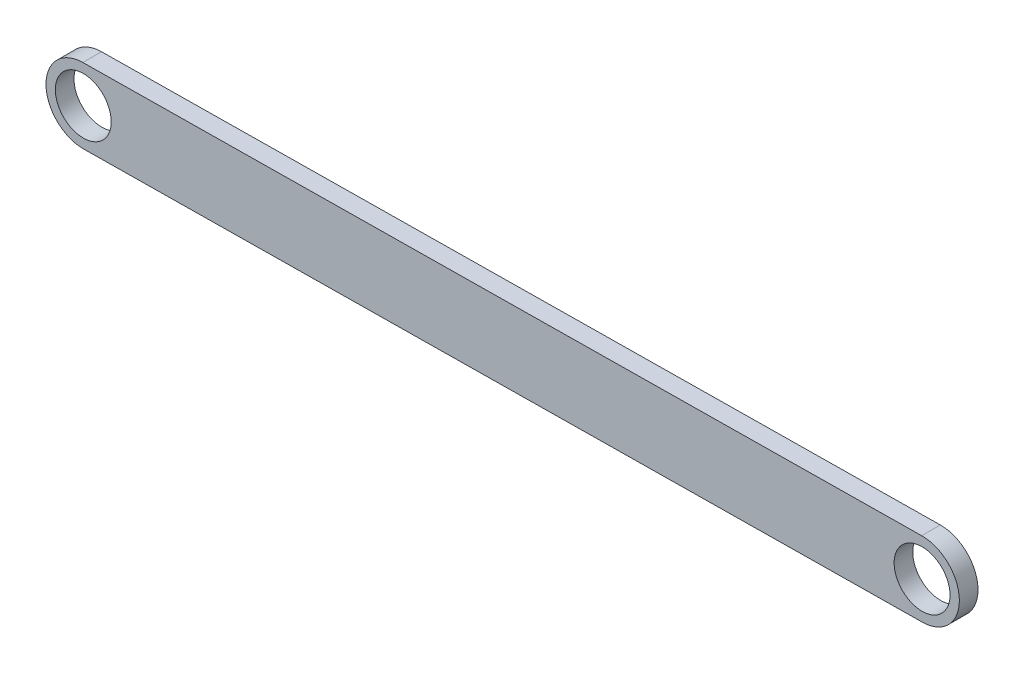
from build123d import *

# Parameters (mm, degrees)
SKETCH_1_R      = 15
EXTRUDE_1_DEPTH = 10


with BuildPart() as part:
    # Эскиз1 → Бобышка-Вытянуть1 (new body)
    with BuildSketch(Plane.XY):
        with BuildLine():
            Line((-0.228494624, 20), (449.771505376, 25.141129032))
            ThreePointArc((449.771505376, 25.141129032), (470, 5.369623656), (450.228494624, -14.858870968))
            Line((450.228494624, -14.858870968), (0.228494624, -20))
            ThreePointArc((0.228494624, -20), (-20, -0.228494624), (-0.228494624, 20))
        make_face()
        Circle(SKETCH_1_R, mode=Mode.SUBTRACT)
        with Locations((450, 5.141129032)):
            Circle(SKETCH_1_R, mode=Mode.SUBTRACT)
    extrude(amount=EXTRUDE_1_DEPTH)


solid = part.part
